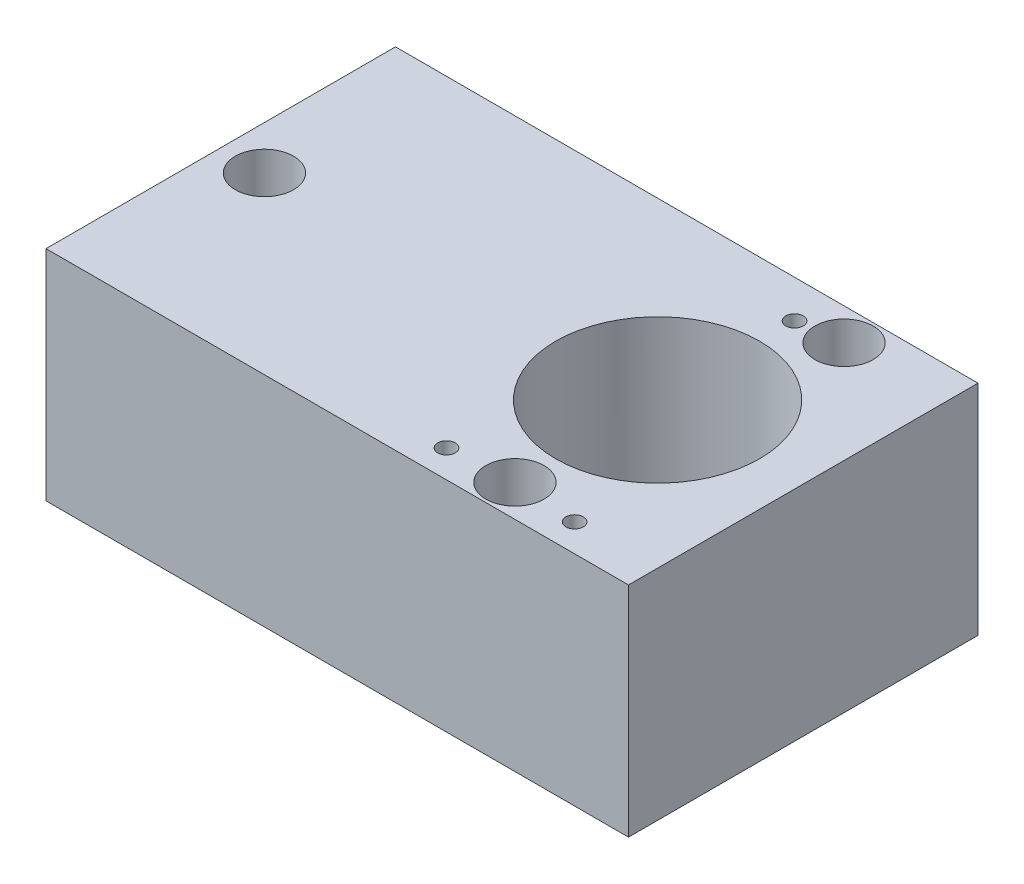
from build123d import *

# Parameters (mm, degrees)
SKETCH_1_W          = 20
SKETCH_1_H          = 12
EXTRUDE_1_DEPTH     = 2.5
SKETCH_1_8_R        = 0.5
CUT_EXTRUDE_1_DEPTH = 3
SKETCH_1_9_R        = 2.6
SKETCH_1_9_R_2      = 1.25
CUT_EXTRUDE_3_DEPTH = 2.5
EXTRUDE_START       = 2.5
SKETCH_1_10_W       = 20
SKETCH_1_10_H       = 12
SKETCH_1_10_R       = 3.5
EXTRUDE_2_DEPTH     = 5
SKETCH_2_R          = 0.7
CUT_EXTRUDE_4_DEPTH = 25.5
CUT_EXTRUDE_START   = -7.5
SKETCH_2_3_R        = 1
CUT_EXTRUDE_5_DEPTH = 5.5
SKETCH_2_6_R        = 0.3
CUT_EXTRUDE_6_DEPTH = 6


with BuildPart() as part:
    # 草图1 → 凸台-拉伸1 (new body)
    with BuildSketch(Plane(origin=(0, 0, 0), x_dir=(1, 0, 0), z_dir=(0, 1, 0))):
        with Locations((10, -6)):
            Rectangle(SKETCH_1_W, SKETCH_1_H)
    extrude(amount=EXTRUDE_1_DEPTH)

    # 草图1<8> → 切除-拉伸1 (cut)
    with BuildSketch(Plane(origin=(0, 0, 0), x_dir=(1, 0, 0), z_dir=(0, 1, 0))):
        with Locations(Location((7.678736094, -8.970584613, 0), (0, 0, 90))):
            Circle(SKETCH_1_8_R)
    extrude(amount=CUT_EXTRUDE_1_DEPTH, mode=Mode.SUBTRACT)

    # 草图1<9> → 切除-拉伸3 (cut)
    with BuildSketch(Plane(origin=(0, 0, 0), x_dir=(1, 0, 0), z_dir=(0, 1, 0))):
        with Locations(Location((9.847079862, -3.807418404, 0), (0, 0, 270))):
            Circle(SKETCH_1_9_R)
        with Locations(Location((15, -6, 0), (0, 0, 270))):
            Circle(SKETCH_1_9_R_2)
    extrude(amount=CUT_EXTRUDE_3_DEPTH, mode=Mode.SUBTRACT)

    # 草图1<10> → 凸台-拉伸2 (add)
    with BuildSketch(Plane(origin=(0, 0, 0), x_dir=(1, 0, 0), z_dir=(0, 1, 0)).offset(EXTRUDE_START)):
        with Locations((10, -6)):
            Rectangle(SKETCH_1_10_W, SKETCH_1_10_H)
        with Locations(Location((15, -6, 0), (0, 0, 90))):
            Circle(SKETCH_1_10_R, mode=Mode.SUBTRACT)
    extrude(amount=EXTRUDE_2_DEPTH)

    # 草图2 → 切除-拉伸4 (cut, through all)
    with BuildSketch(Plane.XZ):
        with Locations(Location((15, 10.9, 0), (0, 0, 270))):
            Circle(SKETCH_2_R)
        with Locations(Location((1.5, 6, 0), (0, 0, 270))):
            Circle(SKETCH_2_R)
        with Locations(Location((16.5, 1.1, 0), (0, 0, 270))):
            Circle(SKETCH_2_R)
    extrude(amount=-CUT_EXTRUDE_4_DEPTH, mode=Mode.SUBTRACT)

    # 草图2<3> → 切除-拉伸5 (cut)
    with BuildSketch(Plane.XZ.offset(CUT_EXTRUDE_START)):
        with Locations(Location((16.5, 1.1, 0), (0, 0, 90))):
            Circle(SKETCH_2_3_R)
        with Locations(Location((15, 10.9, 0), (0, 0, 90))):
            Circle(SKETCH_2_3_R)
        with Locations(Location((1.5, 6, 0), (0, 0, 90))):
            Circle(SKETCH_2_3_R)
    extrude(amount=CUT_EXTRUDE_5_DEPTH, mode=Mode.SUBTRACT)

    # 草图2<6> → 切除-拉伸6 (cut)
    with BuildSketch(Plane.XZ.offset(CUT_EXTRUDE_START)):
        with Locations(Location((12.8, 11.05, 0), (0, 0, 90))):
            Circle(SKETCH_2_6_R)
        with Locations(Location((17.2, 11.05, 0), (0, 0, 90))):
            Circle(SKETCH_2_6_R)
        with Locations(Location((15, 1.3, 0), (0, 0, 90))):
            Circle(SKETCH_2_6_R)
    extrude(amount=CUT_EXTRUDE_6_DEPTH, mode=Mode.SUBTRACT)


solid = part.part
